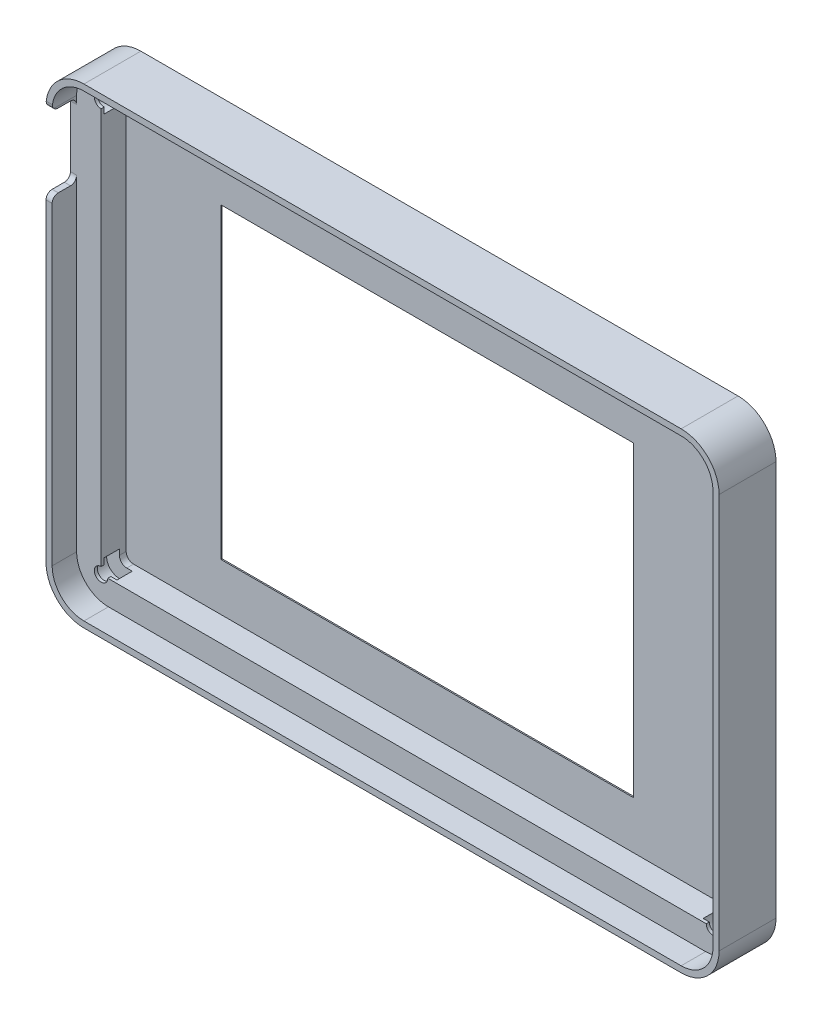
from build123d import *

# Parameters (mm, degrees)
EXTRUDE_1_DEPTH     = 1.2
EXTRUDE_2_DEPTH     = 5.3
SKETCH_3_W          = 67.4
SKETCH_3_H          = 50.2
CUT_EXTRUDE_1_DEPTH = 68.344932994
CHAMFER_1_SIZE      = 1
SKETCH_5_R          = 1.585078886
CUT_EXTRUDE_2_DEPTH = 0.2
SKETCH_6_R          = 2.1
CUT_EXTRUDE_3_DEPTH = 3
EXTRUDE_3_DEPTH     = 0.5
EXTRUDE_4_DEPTH     = 4
SKETCH_10_W         = 4
SKETCH_10_H         = 12
CUT_EXTRUDE_4_DEPTH = 5
FILLET_1_R          = 1


with BuildPart() as part:
    # 草图1 → 凸台-拉伸1 (new body)
    with BuildSketch(Plane.XY):
        with BuildLine():
            Line((48.8, -33.5), (-48.8, -33.5))
            ThreePointArc((-48.8, -33.5), (-49.648528137, -33.148528137), (-50, -32.3))
            Line((-50, -32.3), (-50, 32.3))
            ThreePointArc((-50, 32.3), (-49.648528137, 33.148528137), (-48.8, 33.5))
            Line((-48.8, 33.5), (48.8, 33.5))
            ThreePointArc((48.8, 33.5), (49.648528137, 33.148528137), (50, 32.3))
            Line((50, 32.3), (50, -32.3))
            ThreePointArc((50, -32.3), (49.648528137, -33.148528137), (48.8, -33.5))
        make_face()
    extrude(amount=EXTRUDE_1_DEPTH)

    # 草图2 → 凸台-拉伸2 (add)
    with BuildSketch(Plane.XY):
        with BuildLine():
            Line((-48.8, -38.5), (48.8, -38.5))
            ThreePointArc((48.8, -38.5), (53.184062043, -36.684062043), (55, -32.3))
            Line((55, -32.3), (55, 32.3))
            ThreePointArc((55, 32.3), (53.184062043, 36.684062043), (48.8, 38.5))
            Line((48.8, 38.5), (-48.8, 38.5))
            ThreePointArc((-48.8, 38.5), (-53.184062043, 36.684062043), (-55, 32.3))
            Line((-55, 32.3), (-55, -32.3))
            ThreePointArc((-55, -32.3), (-53.184062043, -36.684062043), (-48.8, -38.5))
        make_face()
        with BuildLine():
            Line((50, -32.3), (50, 32.3))
            ThreePointArc((50, 32.3), (49.648528137, 33.148528137), (48.8, 33.5))
            Line((48.8, 33.5), (-48.8, 33.5))
            ThreePointArc((-48.8, 33.5), (-49.648528137, 33.148528137), (-50, 32.3))
            Line((-50, 32.3), (-50, -32.3))
            ThreePointArc((-50, -32.3), (-49.648528137, -33.148528137), (-48.8, -33.5))
            Line((-48.8, -33.5), (48.8, -33.5))
            ThreePointArc((48.8, -33.5), (49.648528137, -33.148528137), (50, -32.3))
        make_face(mode=Mode.SUBTRACT)
    extrude(amount=EXTRUDE_2_DEPTH)

    # 草图3 → 切除-拉伸1 (cut, through all)
    with BuildSketch(Plane(origin=(0, 0, 0), x_dir=(-1, 0, 0), z_dir=(0, 0, -1))):
        with Locations((0.8, -0.6)):
            Rectangle(SKETCH_3_W, SKETCH_3_H)
    extrude(amount=-CUT_EXTRUDE_1_DEPTH, mode=Mode.SUBTRACT)

    # 倒角1
    chamfer_1_edges = [part.edges().sort_by_distance(p)[0] for p in [
        (-34.5, -0.6, 0),
        (-0.8, -25.7, 0),
        (-0.8, 24.5, 0),
        (32.9, -0.6, 0),
    ]]
    chamfer(chamfer_1_edges, length=CHAMFER_1_SIZE)

    # 草图5 → 切除-拉伸2 (cut)
    with BuildSketch(Plane(origin=(0, 0, 0), x_dir=(-1, 0, 0), z_dir=(0, 0, -1))):
        with Locations((-46.577472533, 30.889007125)):
            Circle(SKETCH_5_R)
    extrude(amount=-CUT_EXTRUDE_2_DEPTH, mode=Mode.SUBTRACT)

    # 草图6 → 切除-拉伸3 (cut)
    with BuildSketch(Plane.XY.offset(5.3)):
        with Locations((-50, -33.5)):
            Circle(SKETCH_6_R)
        with Locations((50, -33.5)):
            Circle(SKETCH_6_R)
        with Locations((50, 33.5)):
            Circle(SKETCH_6_R)
        with Locations((-50, 33.5)):
            Circle(SKETCH_6_R)
    extrude(amount=-CUT_EXTRUDE_3_DEPTH, mode=Mode.SUBTRACT)

    # 草图8 → 凸台-拉伸3 (add)
    with BuildSketch(Plane.XY.offset(5.3)):
        with BuildLine():
            Line((-50, -31.4), (-50, -32.4))
            ThreePointArc((-50, -32.4), (-50.777817459, -34.277817459), (-48.9, -33.5))
            Line((-48.9, -33.5), (-47.9, -33.5))
            ThreePointArc((-47.9, -33.5), (-51.48492424, -34.98492424), (-50, -31.4))
        make_face()
        with BuildLine():
            Line((47.9, -33.5), (48.9, -33.5))
            ThreePointArc((48.9, -33.5), (50.777817459, -34.277817459), (50, -32.4))
            Line((50, -32.4), (50, -31.4))
            ThreePointArc((50, -31.4), (51.48492424, -34.98492424), (47.9, -33.5))
        make_face()
        with BuildLine():
            Line((-47.9, 33.5), (-48.9, 33.5))
            ThreePointArc((-48.9, 33.5), (-50.777817459, 34.277817459), (-50, 32.4))
            Line((-50, 32.4), (-50, 31.4))
            ThreePointArc((-50, 31.4), (-51.48492424, 34.98492424), (-47.9, 33.5))
        make_face()
        with BuildLine():
            Line((50, 31.4), (50, 32.4))
            ThreePointArc((50, 32.4), (50.777817459, 34.277817459), (48.9, 33.5))
            Line((48.9, 33.5), (47.9, 33.5))
            ThreePointArc((47.9, 33.5), (51.48492424, 34.98492424), (50, 31.4))
        make_face()
    extrude(amount=-EXTRUDE_3_DEPTH)

    # 草图9 → 凸台-拉伸4 (add)
    with BuildSketch(Plane.XY.offset(5.3)):
        with BuildLine():
            Line((-55, 32.3), (-55, -32.3))
            ThreePointArc((-55, -32.3), (-53.184062043, -36.684062043), (-48.8, -38.5))
            Line((-48.8, -38.5), (48.8, -38.5))
            ThreePointArc((48.8, -38.5), (53.184062043, -36.684062043), (55, -32.3))
            Line((55, -32.3), (55, 32.3))
            ThreePointArc((55, 32.3), (53.184062043, 36.684062043), (48.8, 38.5))
            Line((48.8, 38.5), (-48.8, 38.5))
            ThreePointArc((-48.8, 38.5), (-53.184062043, 36.684062043), (-55, 32.3))
        make_face()
        with BuildLine():
            Line((-54, 32.3), (-54, -32.3))
            ThreePointArc((-54, -32.3), (-52.476955262, -35.976955262), (-48.8, -37.5))
            Line((-48.8, -37.5), (48.8, -37.5))
            ThreePointArc((48.8, -37.5), (52.476955262, -35.976955262), (54, -32.3))
            Line((54, -32.3), (54, 32.3))
            ThreePointArc((54, 32.3), (52.476955262, 35.976955262), (48.8, 37.5))
            Line((48.8, 37.5), (-48.8, 37.5))
            ThreePointArc((-48.8, 37.5), (-52.476955262, 35.976955262), (-54, 32.3))
        make_face(mode=Mode.SUBTRACT)
    extrude(amount=EXTRUDE_4_DEPTH)

    # 草图10 → 切除-拉伸4 (cut, symmetric)
    with BuildSketch(Plane.ZY.offset(55)):
        with Locations((7.3, 26)):
            Rectangle(SKETCH_10_W, SKETCH_10_H)
    extrude(amount=CUT_EXTRUDE_4_DEPTH, both=True, mode=Mode.SUBTRACT)

    # 圆角1
    fillet_1_edges = [part.edges().sort_by_distance(p)[0] for p in [
        (-54.5, 32, 9.3),
        (-54.5, 20, 9.3),
        (-54.5, 32, 5.3),
        (-54.5, 20, 5.3),
    ]]
    fillet(fillet_1_edges, radius=FILLET_1_R)


solid = part.part
